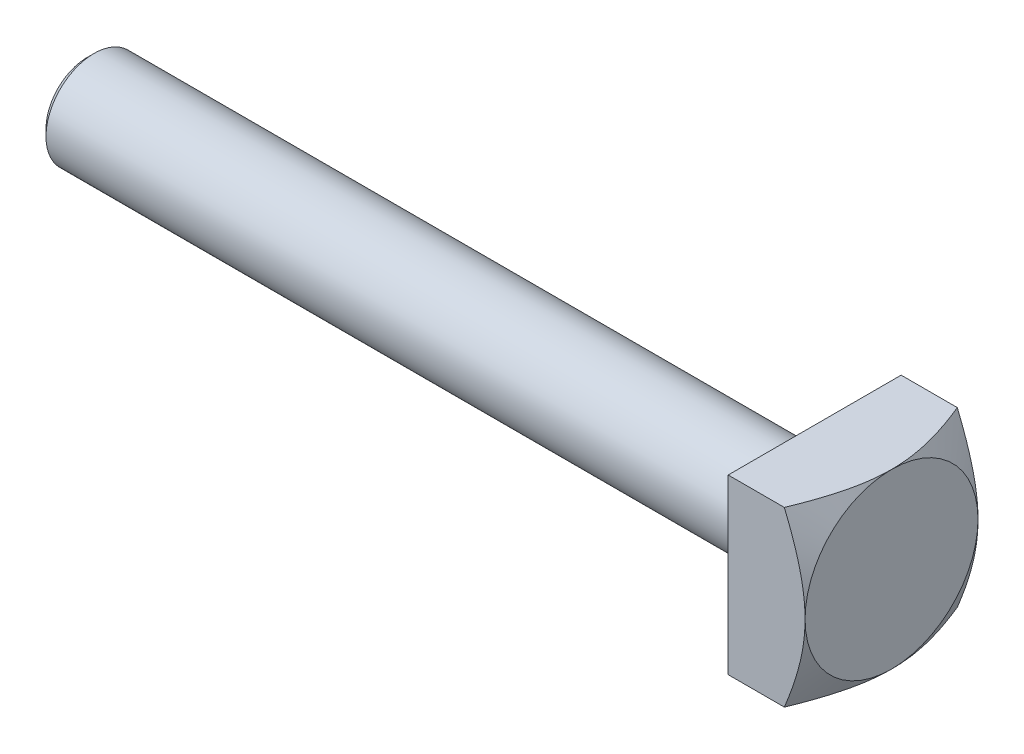
from build123d import *

# Parameters (mm, degrees)
SKETCH4_W           = 18
SKETCH4_H           = 18
BOSS_EXTRUDE1_DEPTH = 8
SKETCH5_OUTSIDE_W   = 72.14
SKETCH5_OUTSIDE_H   = 72.14
SKETCH5_OUTSIDE_R   = 9
CUT_EXTRUDE3_DEPTH  = 10
CUT_EXTRUDE3_DRAFT  = -60


with BuildPart() as part:
    # Sketch1 → Revolve1 (revolve)
    with BuildSketch(Plane.XY, mode=Mode.PRIVATE) as revolve1_sk:
        Polygon((-33.667489974, 5), (-34.374596755, 4.292893219), (-34.374596755, 0), (41.332510026, 0), (41.332510026, 5), align=None)
    revolve(revolve1_sk.sketch.rotate(Axis((-59.973351377, 0, 0), (1, 0, 0)), 180), axis=Axis((-59.973351377, 0, 0), (1, 0, 0)))

    # Sketch4 → Boss-Extrude1 (add)
    with BuildSketch(Plane(origin=(41.332510026, 0, 0), x_dir=(0, 0, -1), z_dir=(1, 0, 0))):
        Rectangle(SKETCH4_W, SKETCH4_H)
    extrude(amount=BOSS_EXTRUDE1_DEPTH)


with BuildPart() as cut_extrude3_tool:
    # Sketch5 outside → Cut-Extrude3 (with draft: the straight prism first)
    with BuildSketch(Plane(origin=(49.332510026, 0, 0), x_dir=(0, 0, -1), z_dir=(1, 0, 0))):
        Rectangle(SKETCH5_OUTSIDE_W, SKETCH5_OUTSIDE_H)
        Circle(SKETCH5_OUTSIDE_R, mode=Mode.SUBTRACT)
    extrude(amount=-CUT_EXTRUDE3_DEPTH)
    # Cut-Extrude3: the draft: its side faces are tilted about the plane it starts from
    cut_extrude3_sides = [cut_extrude3_tool.faces().sort_by_distance(p)[0] for p in [
        (44.332510026, -36.07, 0),
        (44.332510026, 0, -36.07),
        (44.332510026, 36.07, 0),
        (44.332510026, 0, 36.07),
        (44.332510026, 0, 9),
    ]]
    draft(cut_extrude3_sides, Plane(origin=(49.332510026, 0, 0), x_dir=(0, 0, -1), z_dir=(1, 0, 0)), CUT_EXTRUDE3_DRAFT)


with BuildPart() as part_1:
    add(part.part)

    # Cut-Extrude3: cut by cut_extrude3_tool
    add(cut_extrude3_tool.part, mode=Mode.SUBTRACT)


solid = part_1.part
